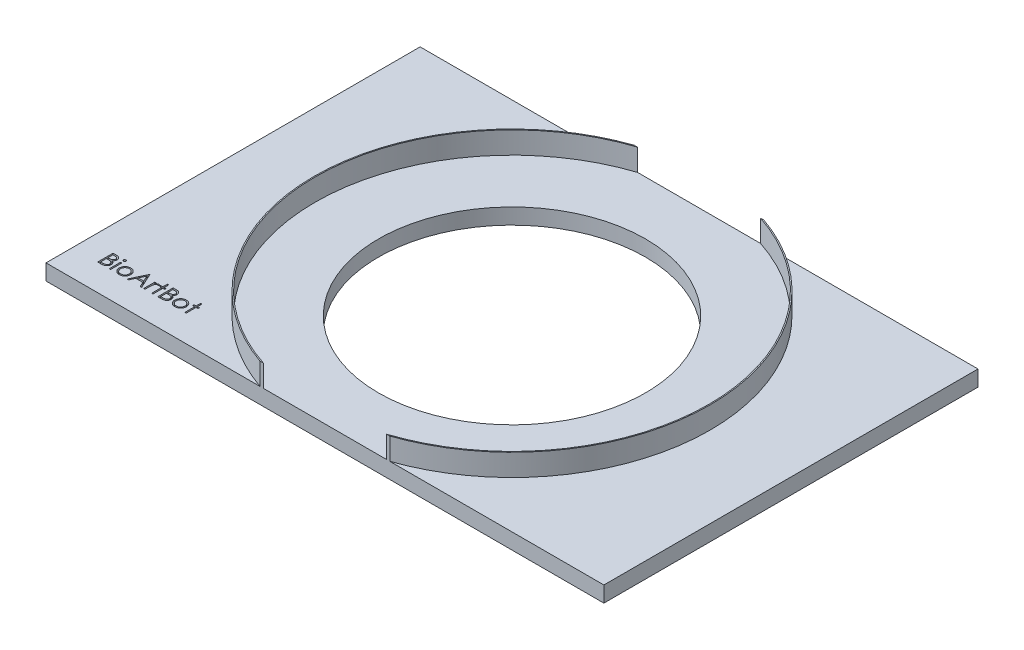
from build123d import *

# Parameters (mm, degrees)
BOSS_EXTRUDE4_DEPTH   = 3.6
BOSS_EXTRUDE4_2_DEPTH = 3.6
BOSS_EXTRUDE5_DEPTH   = 5
SKETCH1_9_R           = 30.5
BOSS_EXTRUDE7_DEPTH   = 3.6
SKETCH2_W             = 0.314102564
SKETCH2_H             = 2.557692308
CUT_EXTRUDE1_DEPTH    = 1


with BuildPart() as part:
    # Sketch1 → Boss-Extrude4 (new body)
    with BuildSketch(Plane(origin=(0, 0, 0), x_dir=(1, 0, 0), z_dir=(0, 1, 0))):
        with BuildLine():
            Line((-63.75, 42.75), (-63.75, -42.75))
            Line((-63.75, -42.75), (-14.832396974, -42.75))
            ThreePointArc((-14.832396974, -42.75), (-45.25, 0), (-14.832396974, 42.75))
            Line((-14.832396974, 42.75), (-63.75, 42.75))
        make_face()
    extrude(amount=-BOSS_EXTRUDE4_DEPTH)



with BuildPart() as body_2:
    # Sketch1 → Boss-Extrude4 2 (new body)
    with BuildSketch(Plane(origin=(0, 0, 0), x_dir=(1, 0, 0), z_dir=(0, 1, 0))):
        with BuildLine():
            ThreePointArc((45.25, 0), (36.869556975, -26.233533282), (14.832396974, -42.75))
            Line((14.832396974, -42.75), (63.75, -42.75))
            Line((63.75, -42.75), (63.75, 42.75))
            Line((63.75, 42.75), (14.832396974, 42.75))
            ThreePointArc((14.832396974, 42.75), (36.869556975, 26.233533282), (45.25, 0))
        make_face()
    extrude(amount=-BOSS_EXTRUDE4_2_DEPTH)


with BuildPart() as body_3:
    # Sketch1<6> → Boss-Extrude5 (new body)
    with BuildSketch(Plane(origin=(0, 0, 0), x_dir=(1, 0, 0), z_dir=(0, 1, 0))):
        with BuildLine():
            ThreePointArc((-14.832396974, 42.75), (-45.25, 0), (-14.832396974, -42.75))
            Line((-14.832396974, -42.75), (-14.051245496, -42.75))
            ThreePointArc((-14.051245496, -42.75), (-45, 0), (-14.051245496, 42.75))
            Line((-14.051245496, 42.75), (-14.832396974, 42.75))
        make_face()
        with BuildLine():
            Line((14.051245496, -42.75), (14.832396974, -42.75))
            ThreePointArc((14.832396974, -42.75), (36.869556975, -26.233533282), (45.25, 0))
            ThreePointArc((45.25, 0), (36.869556975, 26.233533282), (14.832396974, 42.75))
            Line((14.832396974, 42.75), (14.051245496, 42.75))
            ThreePointArc((14.051245496, 42.75), (36.450693048, 26.388387149), (45, 0))
            ThreePointArc((45, 0), (36.450693048, -26.388387149), (14.051245496, -42.75))
        make_face()
    extrude(amount=BOSS_EXTRUDE5_DEPTH)


with BuildPart() as part_1:
    add(part.part)

    add(body_2.part)  # Boss-Extrude7 merges body 2

    add(body_3.part)  # Boss-Extrude7 merges body 3
    # Sketch1<9> → Boss-Extrude7 (add)
    # profile 1 of 5: a face of its own
    with BuildSketch(Plane(origin=(0, 0, 0), x_dir=(1, 0, 0), z_dir=(0, 1, 0))):
        with BuildLine():
            ThreePointArc((-14.051245496, 42.75), (-45, 0), (-14.051245496, -42.75))
            Line((-14.051245496, -42.75), (14.051245496, -42.75))
            ThreePointArc((14.051245496, -42.75), (36.450693048, -26.388387149), (45, 0))
            ThreePointArc((45, 0), (36.450693048, 26.388387149), (14.051245496, 42.75))
            Line((14.051245496, 42.75), (-14.051245496, 42.75))
        make_face()
        with Locations(Location((0, 0, 0), (0, 0, 270))):
            Circle(SKETCH1_9_R, mode=Mode.SUBTRACT)
    # profile 2 of 5: a face of its own
    with BuildSketch(Plane(origin=(0, 0, 0), x_dir=(1, 0, 0), z_dir=(0, 1, 0))):
        with BuildLine():
            ThreePointArc((-14.832396974, 42.75), (-45.25, 0), (-14.832396974, -42.75))
            Line((-14.832396974, -42.75), (-14.051245496, -42.75))
            ThreePointArc((-14.051245496, -42.75), (-45, 0), (-14.051245496, 42.75))
            Line((-14.051245496, 42.75), (-14.832396974, 42.75))
        make_face()
    # profile 3 of 5: a face of its own
    with BuildSketch(Plane(origin=(0, 0, 0), x_dir=(1, 0, 0), z_dir=(0, 1, 0))):
        with BuildLine():
            Line((14.051245496, -42.75), (14.832396974, -42.75))
            ThreePointArc((14.832396974, -42.75), (36.869556975, -26.233533282), (45.25, 0))
            ThreePointArc((45.25, 0), (36.869556975, 26.233533282), (14.832396974, 42.75))
            Line((14.832396974, 42.75), (14.051245496, 42.75))
            ThreePointArc((14.051245496, 42.75), (36.450693048, 26.388387149), (45, 0))
            ThreePointArc((45, 0), (36.450693048, -26.388387149), (14.051245496, -42.75))
        make_face()
    # profile 4 of 5: a face of its own
    with BuildSketch(Plane(origin=(0, 0, 0), x_dir=(1, 0, 0), z_dir=(0, 1, 0))):
        with BuildLine():
            ThreePointArc((-14.832396974, 42.75), (-45.25, 0), (-14.832396974, -42.75))
            Line((-14.832396974, -42.75), (-14.051245496, -42.75))
            ThreePointArc((-14.051245496, -42.75), (-45, 0), (-14.051245496, 42.75))
            Line((-14.051245496, 42.75), (-14.832396974, 42.75))
        make_face()
    # profile 5 of 5: a face of its own
    with BuildSketch(Plane(origin=(0, 0, 0), x_dir=(1, 0, 0), z_dir=(0, 1, 0))):
        with BuildLine():
            Line((14.051245496, -42.75), (14.832396974, -42.75))
            ThreePointArc((14.832396974, -42.75), (36.869556975, -26.233533282), (45.25, 0))
            ThreePointArc((45.25, 0), (36.869556975, 26.233533282), (14.832396974, 42.75))
            Line((14.832396974, 42.75), (14.051245496, 42.75))
            ThreePointArc((14.051245496, 42.75), (36.450693048, 26.388387149), (45, 0))
            ThreePointArc((45, 0), (36.450693048, -26.388387149), (14.051245496, -42.75))
        make_face()
    extrude(amount=-BOSS_EXTRUDE7_DEPTH)

    # Sketch2 → Cut-Extrude1 (cut)
    # profile 1 of 10: a face of its own
    with BuildSketch(Plane(origin=(0, 0, 0), x_dir=(1, 0, 0), z_dir=(0, 1, 0))):
        with BuildLine():
            Line((-58.009767253, -33.174427037), (-57.326874624, -33.174427037))
            add(Edge.make_bspline(
                [(-57.326874624, -33.174427037), (-57.293446146, -33.174602787), (-57.228653436, -33.174943435), (-57.134433994, -33.180226566), (-57.046185183, -33.187430236), (-56.963881411, -33.198860329), (-56.887560709, -33.212652106), (-56.816993071, -33.229353922), (-56.752402899, -33.249380536), (-56.675290163, -33.281226817), (-56.587369502, -33.328549985), (-56.492171109, -33.39847855), (-56.41076687, -33.484011013), (-56.340580552, -33.580493669), (-56.284779433, -33.686629441), (-56.244410136, -33.799888629), (-56.21885226, -33.918810371), (-56.216223826, -34.000453549), (-56.214895458, -34.041714697)],
                knots=[0, 0, 0, 0, 1.001505555, 1.941167018, 2.826882275, 3.653841531, 4.429895133, 5.150066043, 5.825578002, 6.45369114, 7.647487171, 8.808567382, 9.977351308, 11.170798116, 12.373658725, 13.556498008, 14.765093433, 16, 16, 16, 16], degree=3))
            add(Edge.make_bspline(
                [(-56.214895458, -34.041714697), (-56.215988676, -34.080367253), (-56.218136953, -34.15632317), (-56.238679713, -34.267417279), (-56.270840381, -34.373168498), (-56.31554563, -34.473190883), (-56.373647627, -34.565224496), (-56.442505945, -34.650011762), (-56.525582748, -34.723962819), (-56.587825988, -34.765305722), (-56.619442733, -34.786306043)],
                knots=[0, 0, 0, 0, 1.044552857, 2.05264487, 3.044412934, 4.028983338, 5.005914585, 5.980388656, 6.974128949, 8, 8, 8, 8], degree=3))
            add(Edge.make_bspline(
                [(-56.619442733, -34.786306043), (-56.579682306, -34.801571042), (-56.503610758, -34.830776766), (-56.398924746, -34.88241223), (-56.308729901, -34.938574341), (-56.232332755, -34.999906191), (-56.1669951, -35.066015002), (-56.109942158, -35.137870116), (-56.061260784, -35.216408874), (-56.019547861, -35.300812409), (-55.986999105, -35.390218878), (-55.9626232, -35.483789654), (-55.948655751, -35.581189209), (-55.94666811, -35.647474588), (-55.945664688, -35.680937453)],
                knots=[0, 0, 0, 0, 1.27268992, 2.434971085, 3.483601985, 4.442670788, 5.356604649, 6.2567628, 7.179492994, 8.113709626, 9.066344395, 10.018646069, 10.999752585, 12, 12, 12, 12], degree=3))
            add(Edge.make_bspline(
                [(-55.945664688, -35.680937453), (-55.946641534, -35.715104325), (-55.948563506, -35.782328604), (-55.962743478, -35.881083738), (-55.986752585, -35.975458685), (-56.019823732, -36.066063867), (-56.062986046, -36.152724002), (-56.11551401, -36.235537266), (-56.178145574, -36.313671596), (-56.248208443, -36.38799522), (-56.327470588, -36.454823007), (-56.412986343, -36.514338714), (-56.505832663, -36.563284776), (-56.604484657, -36.604400797), (-56.710048973, -36.635807996), (-56.822051581, -36.65778057), (-56.940395883, -36.672585607), (-57.021605634, -36.673802811), (-57.063252829, -36.674427037)],
                knots=[0, 0, 0, 0, 0.978564426, 1.925352924, 2.850884081, 3.763762016, 4.682927383, 5.618979971, 6.567305752, 7.547517671, 8.540179244, 9.531824382, 10.526200242, 11.540722885, 12.589160233, 13.674978461, 14.80764778, 16, 16, 16, 16], degree=3))
            Line((-57.063252829, -36.674427037), (-58.009767253, -36.674427037))
            Line((-58.009767253, -36.674427037), (-58.009767253, -33.174427037))
        make_face()
        with BuildLine():
            Line((-57.695664688, -33.533401396), (-57.695664688, -34.655196267))
            Line((-57.695664688, -34.655196267), (-57.484627028, -34.655196267))
            add(Edge.make_bspline(
                [(-57.484627028, -34.655196267), (-57.453778233, -34.654796344), (-57.394172074, -34.654023612), (-57.307852177, -34.651810095), (-57.227727159, -34.645612051), (-57.153935326, -34.639415789), (-57.086592882, -34.629341201), (-57.02584902, -34.617349079), (-56.970750423, -34.604666173), (-56.907210878, -34.583096687), (-56.835137929, -34.551219011), (-56.758304825, -34.501747175), (-56.690570356, -34.442822822), (-56.633373168, -34.37483186), (-56.586561697, -34.299965674), (-56.554047982, -34.219418794), (-56.532000698, -34.135198662), (-56.530009167, -34.077380409), (-56.528998022, -34.048024793)],
                knots=[0, 0, 0, 0, 1.156816544, 2.235205308, 3.236616184, 4.169592532, 5.011045266, 5.787822928, 6.49130361, 7.128639758, 8.301311294, 9.436451833, 10.541879658, 11.654887649, 12.756523258, 13.837046038, 14.901820046, 16, 16, 16, 16], degree=3))
            add(Edge.make_bspline(
                [(-56.528998022, -34.048024793), (-56.529524202, -34.028599022), (-56.530556362, -33.990493249), (-56.539009664, -33.934943895), (-56.553377239, -33.882700143), (-56.571831532, -33.833046032), (-56.597620221, -33.787534182), (-56.627983684, -33.744590987), (-56.664669374, -33.705678868), (-56.706426687, -33.66930937), (-56.75443531, -33.637064842), (-56.808666602, -33.608824079), (-56.869854279, -33.586083302), (-56.936967134, -33.56616715), (-57.011038221, -33.552178856), (-57.091212775, -33.540525468), (-57.178147494, -33.534592726), (-57.238292596, -33.533807363), (-57.269382637, -33.533401396)],
                knots=[0, 0, 0, 0, 0.91205012, 1.789085906, 2.630437955, 3.453916878, 4.269457761, 5.079663411, 5.91843418, 6.774407191, 7.675494373, 8.627863946, 9.638891023, 10.736472738, 11.911756761, 13.175263542, 14.539845004, 16, 16, 16, 16], degree=3))
            Line((-57.269382637, -33.533401396), (-57.695664688, -33.533401396))
        make_face(mode=Mode.SUBTRACT)
        with BuildLine():
            Line((-57.695664688, -35.014170626), (-57.695664688, -36.315452678))
            Line((-57.695664688, -36.315452678), (-57.248348983, -36.315452678))
            add(Edge.make_bspline(
                [(-57.248348983, -36.315452678), (-57.216330057, -36.31506893), (-57.154617799, -36.314329308), (-57.065516569, -36.311914753), (-56.982933465, -36.306422477), (-56.907245329, -36.297776628), (-56.837634877, -36.288398179), (-56.774937173, -36.275786898), (-56.71864398, -36.261337937), (-56.653369672, -36.239003765), (-56.579866164, -36.204307294), (-56.500655308, -36.151993068), (-56.430229089, -36.08966976), (-56.37042383, -36.017538846), (-56.321410842, -35.939107519), (-56.285755387, -35.855962169), (-56.26376453, -35.769476641), (-56.261102361, -35.710509929), (-56.259767253, -35.680937453)],
                knots=[0, 0, 0, 0, 1.160039823, 2.235823828, 3.228722157, 4.157150951, 4.99529583, 5.772374946, 6.472645482, 7.099169577, 8.269452708, 9.405989375, 10.527446681, 11.663510218, 12.788923519, 13.866172445, 14.929861265, 16, 16, 16, 16], degree=3))
            add(Edge.make_bspline(
                [(-56.259767253, -35.680937453), (-56.260043357, -35.662444113), (-56.260591112, -35.625755731), (-56.268851727, -35.571839912), (-56.280865597, -35.519614038), (-56.296397031, -35.468936298), (-56.319016498, -35.420722922), (-56.345423043, -35.374020362), (-56.376384444, -35.328766883), (-56.42462861, -35.271554629), (-56.494800595, -35.205637616), (-56.59450737, -35.141100114), (-56.707879668, -35.089052307), (-56.790107161, -35.066952831), (-56.832583759, -35.055536812)],
                knots=[0, 0, 0, 0, 0.723448775, 1.435228256, 2.130040452, 2.821711965, 3.505591119, 4.210454504, 4.921174351, 5.648778258, 7.137944449, 8.670945889, 10.280296675, 12, 12, 12, 12], degree=3))
            add(Edge.make_bspline(
                [(-56.832583759, -35.055536812), (-56.849612855, -35.052081728), (-56.886535447, -35.044590394), (-56.946743028, -35.03668269), (-57.015478896, -35.02963763), (-57.092901774, -35.024426473), (-57.179109615, -35.019039929), (-57.274286533, -35.016945108), (-57.378043848, -35.014445848), (-57.450036221, -35.014264714), (-57.487431515, -35.014170626)],
                knots=[0, 0, 0, 0, 0.634451884, 1.375622551, 2.216452059, 3.157844607, 4.20941857, 5.370758133, 6.634282058, 8, 8, 8, 8], degree=3))
            Line((-57.487431515, -35.014170626), (-57.695664688, -35.014170626))
        make_face(mode=Mode.SUBTRACT)
    # profile 2 of 10: a face of its own
    with BuildSketch(Plane(origin=(0, 0, 0), x_dir=(1, 0, 0), z_dir=(0, 1, 0))):
        with BuildLine():
            add(Edge.make_bspline(
                [(-55.206682317, -33.039811652), (-55.187191001, -33.040715804), (-55.149023261, -33.042486308), (-55.093829993, -33.057647786), (-55.043572981, -33.083347471), (-54.998995248, -33.117827152), (-54.960743362, -33.158376595), (-54.933962651, -33.205637564), (-54.916750255, -33.256696202), (-54.9146717, -33.292311292), (-54.913613406, -33.310444665)],
                knots=[0, 0, 0, 0, 1.055194115, 2.066272739, 3.074728998, 4.095836921, 5.109056067, 6.073838105, 7.019297344, 8, 8, 8, 8], degree=3))
            add(Edge.make_bspline(
                [(-54.913613406, -33.310444665), (-54.914695566, -33.328107318), (-54.916834868, -33.363024293), (-54.933949356, -33.413197765), (-54.960971594, -33.459802049), (-54.99897072, -33.500272759), (-55.043579481, -33.534733379), (-55.093828267, -33.560438118), (-55.149023715, -33.575598255), (-55.187191154, -33.577368944), (-55.206682317, -33.57827319)],
                knots=[0, 0, 0, 0, 0.96129708, 1.900370562, 2.859976407, 3.87933698, 4.906634145, 5.921202961, 6.938410037, 8, 8, 8, 8], degree=3))
            add(Edge.make_bspline(
                [(-55.206682317, -33.57827319), (-55.225950592, -33.57740347), (-55.263453772, -33.575710673), (-55.317820614, -33.560140656), (-55.367649104, -33.534724583), (-55.412313776, -33.500498398), (-55.449543969, -33.4595535), (-55.476642295, -33.413226206), (-55.493717257, -33.363017052), (-55.495861885, -33.328104886), (-55.49694674, -33.310444665)],
                knots=[0, 0, 0, 0, 1.054934014, 2.053291228, 3.073705704, 4.106921865, 5.123545215, 6.088680038, 7.033164197, 8, 8, 8, 8], degree=3))
            add(Edge.make_bspline(
                [(-55.49694674, -33.310444665), (-55.495885653, -33.292313815), (-55.493801612, -33.256703683), (-55.476629496, -33.20560865), (-55.449769688, -33.158627148), (-55.412289125, -33.117601648), (-55.367655664, -33.083356214), (-55.317818919, -33.057945232), (-55.26345422, -33.042373893), (-55.225950744, -33.040681278), (-55.206682317, -33.039811652)],
                knots=[0, 0, 0, 0, 0.98631895, 1.937192651, 2.907499808, 3.917963147, 4.944918757, 5.95915025, 6.951458133, 8, 8, 8, 8], degree=3))
        make_face()
    # profile 3 of 10: a face of its own
    with BuildSketch(Plane(origin=(0, 0, 0), x_dir=(1, 0, 0), z_dir=(0, 1, 0))):
        with Locations((-55.205280073, -35.395580883)):
            Rectangle(SKETCH2_W, SKETCH2_H)
    # profile 4 of 10: a face of its own
    with BuildSketch(Plane(origin=(0, 0, 0), x_dir=(1, 0, 0), z_dir=(0, 1, 0))):
        with BuildLine():
            add(Edge.make_bspline(
                [(-53.050031676, -34.071862934), (-53.002040403, -34.072884825), (-52.907941245, -34.074888504), (-52.770133359, -34.09630347), (-52.638588223, -34.129050834), (-52.512802031, -34.174322396), (-52.394385736, -34.235004347), (-52.281614492, -34.307413638), (-52.174797483, -34.393196231), (-52.110774453, -34.4595543), (-52.078276868, -34.493237133)],
                knots=[0, 0, 0, 0, 1.054011418, 2.066658804, 3.057071809, 4.030435133, 4.997543892, 5.974964718, 6.972108034, 8, 8, 8, 8], degree=3))
            add(Edge.make_bspline(
                [(-52.078276868, -34.493237133), (-52.050294914, -34.525451119), (-51.994872534, -34.589255661), (-51.923806815, -34.692711274), (-51.862585255, -34.799851374), (-51.813522294, -34.912098701), (-51.77483727, -35.028473372), (-51.747371574, -35.149375383), (-51.731034639, -35.27453773), (-51.728831672, -35.359541569), (-51.72771597, -35.402592101)],
                knots=[0, 0, 0, 0, 1.025258237, 2.030674902, 3.01204498, 3.988269485, 4.97094183, 5.956517959, 6.965070386, 8, 8, 8, 8], degree=3))
            add(Edge.make_bspline(
                [(-51.72771597, -35.402592101), (-51.728697308, -35.445892158), (-51.730636476, -35.531455092), (-51.748980092, -35.657474458), (-51.777511178, -35.77966928), (-51.818343017, -35.897527974), (-51.870701126, -36.011410801), (-51.934591813, -36.120820351), (-52.01046343, -36.225972484), (-52.096467427, -36.325974322), (-52.191519303, -36.418140537), (-52.294635452, -36.498468807), (-52.403789485, -36.567290331), (-52.520432839, -36.622726747), (-52.643500326, -36.666436447), (-52.773257394, -36.697136463), (-52.909502464, -36.715698147), (-53.002529685, -36.71808172), (-53.050031676, -36.719298831)],
                knots=[0, 0, 0, 0, 0.998656419, 1.973391657, 2.932242238, 3.890759089, 4.846373663, 5.82037756, 6.809684879, 7.83454468, 8.860553229, 9.859544525, 10.845671541, 11.83227036, 12.833544569, 13.85385346, 14.904124723, 16, 16, 16, 16], degree=3))
            add(Edge.make_bspline(
                [(-53.050031676, -36.719298831), (-53.097766395, -36.718077635), (-53.191257255, -36.715685861), (-53.327983237, -36.697208578), (-53.457972856, -36.666450595), (-53.581201454, -36.622583103), (-53.698346301, -36.567288559), (-53.808132798, -36.498676869), (-53.911332714, -36.418116714), (-54.006404698, -36.325980777), (-54.092403303, -36.225970821), (-54.168276312, -36.120820782), (-54.232166638, -36.011410689), (-54.284524842, -35.897528004), (-54.325356655, -35.779669272), (-54.353887747, -35.65747446), (-54.372231362, -35.531455091), (-54.37417053, -35.445892158), (-54.375151868, -35.402592101)],
                knots=[0, 0, 0, 0, 1.099876186, 2.154163076, 3.173186993, 4.173200201, 5.163417411, 6.152872554, 7.150605724, 8.17532212, 9.198891216, 10.186952605, 11.159729845, 12.11414092, 13.071450619, 14.029093627, 15.002601286, 16, 16, 16, 16], degree=3))
            add(Edge.make_bspline(
                [(-54.375151868, -35.402592101), (-54.374028558, -35.359775555), (-54.371804596, -35.275006152), (-54.355484087, -35.150079092), (-54.328125531, -35.029381703), (-54.289394134, -34.913456227), (-54.239878943, -34.801700791), (-54.179517655, -34.69429596), (-54.107727023, -34.591308159), (-54.052525071, -34.527586079), (-54.02459097, -34.495340498)],
                knots=[0, 0, 0, 0, 1.031353054, 2.041901799, 3.029428768, 4.008703097, 4.981709435, 5.96992636, 6.972712378, 8, 8, 8, 8], degree=3))
            add(Edge.make_bspline(
                [(-54.02459097, -34.495340498), (-53.992142379, -34.461365559), (-53.928326516, -34.394547863), (-53.820977788, -34.309015339), (-53.708483967, -34.235099265), (-53.588759041, -34.175623049), (-53.463076183, -34.128784532), (-53.33085694, -34.096219016), (-53.192581425, -34.074965661), (-53.098021804, -34.072907484), (-53.050031676, -34.071862934)],
                knots=[0, 0, 0, 0, 1.027980169, 2.021703884, 2.998553061, 3.971491411, 4.943284454, 5.930300938, 6.949603206, 8, 8, 8, 8], degree=3))
        make_face()
        with BuildLine():
            add(Edge.make_bspline(
                [(-53.051433919, -34.385965498), (-53.08537153, -34.38693009), (-53.152370659, -34.388834372), (-53.250990244, -34.403318277), (-53.345930398, -34.426265781), (-53.437371242, -34.458869837), (-53.525004414, -34.500968736), (-53.608913817, -34.552677097), (-53.689346257, -34.613310053), (-53.76472832, -34.682772725), (-53.833910632, -34.758651719), (-53.894388609, -34.839500078), (-53.945813715, -34.924006424), (-53.988653874, -35.012258635), (-54.020561062, -35.105151049), (-54.043734085, -35.201631681), (-54.058204325, -35.301897097), (-54.060090704, -35.370058115), (-54.061049304, -35.404695466)],
                knots=[0, 0, 0, 0, 1.021534396, 2.016698045, 2.994645724, 3.958388632, 4.93408049, 5.916473867, 6.921342795, 7.962252576, 8.998418191, 10.008913653, 10.997312074, 11.973003931, 12.956656626, 13.948281152, 14.957379055, 16, 16, 16, 16], degree=3))
            add(Edge.make_bspline(
                [(-54.061049304, -35.404695466), (-54.05944248, -35.449447493), (-54.056253236, -35.538271899), (-54.030317999, -35.669083021), (-53.986931719, -35.794664874), (-53.92834444, -35.91428126), (-53.854938221, -36.024953538), (-53.768451154, -36.123625022), (-53.669811454, -36.208810833), (-53.560194954, -36.279491679), (-53.441840636, -36.335651435), (-53.316584315, -36.37545041), (-53.185943621, -36.401322103), (-53.09666289, -36.403893577), (-53.051433919, -36.405196267)],
                knots=[0, 0, 0, 0, 1.016792936, 2.018143844, 3.017858371, 4.030088057, 5.03801393, 6.028138512, 7.003788237, 7.991172063, 8.984598303, 9.972568034, 10.972917682, 12, 12, 12, 12], degree=3))
            add(Edge.make_bspline(
                [(-53.051433919, -36.405196267), (-53.00620755, -36.403885987), (-52.916931954, -36.40129953), (-52.786472777, -36.375580711), (-52.661558806, -36.33547705), (-52.543327418, -36.27955484), (-52.433760815, -36.208542425), (-52.334411693, -36.124106048), (-52.248663082, -36.024692197), (-52.175329477, -35.914134668), (-52.115782735, -35.794850316), (-52.072599533, -35.669059844), (-52.046601947, -35.538277802), (-52.043421118, -35.449449471), (-52.041818535, -35.404695466)],
                knots=[0, 0, 0, 0, 1.02726834, 2.027799167, 3.010890988, 4.004497153, 4.992059811, 5.971914811, 6.958719428, 7.966827853, 8.981595046, 9.981490638, 10.983022906, 12, 12, 12, 12], degree=3))
            add(Edge.make_bspline(
                [(-52.041818535, -35.404695466), (-52.042776805, -35.370057908), (-52.044662534, -35.301896483), (-52.059137498, -35.201634029), (-52.082293038, -35.105142433), (-52.114264655, -35.012290429), (-52.156918669, -34.923777925), (-52.209335462, -34.839748198), (-52.269566487, -34.758371652), (-52.339583608, -34.683018011), (-52.414886986, -34.613282974), (-52.495352024, -34.552653585), (-52.579137003, -34.50119599), (-52.666515586, -34.458509749), (-52.757968153, -34.426562409), (-52.852775282, -34.403185777), (-52.950974092, -34.388895581), (-53.017733135, -34.386948439), (-53.051433919, -34.385965498)],
                knots=[0, 0, 0, 0, 1.042956736, 2.052379634, 3.044323526, 4.02829302, 5.004299113, 5.996692471, 7.007513377, 8.048758398, 9.090003419, 10.095195979, 11.07790575, 12.047570684, 13.018257071, 13.989683339, 14.985167495, 16, 16, 16, 16], degree=3))
        make_face(mode=Mode.SUBTRACT)
    # profile 5 of 10: a face of its own
    with BuildSketch(Plane(origin=(0, 0, 0), x_dir=(1, 0, 0), z_dir=(0, 1, 0))):
        Polygon((-49.573869817, -33.174427037), (-47.958485201, -36.674427037), (-48.299931515, -36.674427037), (-48.8173594, -35.552632165), (-50.403998022, -35.552632165), (-50.936149464, -36.674427037), (-51.278998022, -36.674427037), (-49.618741611, -33.174427037), align=None)
        Polygon((-49.599811323, -33.856618543), (-50.233625426, -35.193657806), (-48.982824144, -35.193657806), align=None, mode=Mode.SUBTRACT)
    # profile 6 of 10: a face of its own
    with BuildSketch(Plane(origin=(0, 0, 0), x_dir=(1, 0, 0), z_dir=(0, 1, 0))):
        with BuildLine():
            Line((-47.509767253, -34.116734729), (-47.195664688, -34.116734729))
            Line((-47.195664688, -34.116734729), (-47.195664688, -34.493237133))
            add(Edge.make_bspline(
                [(-47.195664688, -34.493237133), (-47.17247593, -34.458181304), (-47.128127609, -34.391137305), (-47.054414679, -34.302468004), (-46.978911348, -34.229052958), (-46.901256161, -34.170549439), (-46.820878061, -34.12673632), (-46.739541109, -34.094643285), (-46.655965639, -34.07566597), (-46.599803715, -34.073132311), (-46.571666291, -34.071862934)],
                knots=[0, 0, 0, 0, 1.2804753, 2.448899062, 3.506932113, 4.484331642, 5.4025378, 6.288909075, 7.142734305, 8, 8, 8, 8], degree=3))
            add(Edge.make_bspline(
                [(-46.571666291, -34.071862934), (-46.549839964, -34.073053461), (-46.504930879, -34.075503046), (-46.436948289, -34.092713871), (-46.366904838, -34.120191894), (-46.32176245, -34.146032116), (-46.298228791, -34.159503158)],
                knots=[0, 0, 0, 0, 0.901110191, 1.854092781, 2.881294221, 4, 4, 4, 4], degree=3))
            Line((-46.298228791, -34.159503158), (-46.470704753, -34.431538415))
            add(Edge.make_bspline(
                [(-46.470704753, -34.431538415), (-46.485813774, -34.424798149), (-46.514493588, -34.412003833), (-46.556448154, -34.396861823), (-46.595129491, -34.387945907), (-46.61977305, -34.38659519), (-46.631261644, -34.385965498)],
                knots=[0, 0, 0, 0, 1.180555205, 2.24091978, 3.179933427, 4, 4, 4, 4], degree=3))
            add(Edge.make_bspline(
                [(-46.631261644, -34.385965498), (-46.656467377, -34.387645536), (-46.707879767, -34.391072325), (-46.783364266, -34.418011133), (-46.856611472, -34.461536373), (-46.914783134, -34.509807484), (-46.959825387, -34.556355282), (-46.991965613, -34.597003685), (-47.02144836, -34.642582316), (-47.04961858, -34.692312), (-47.075284874, -34.747041846), (-47.099239543, -34.806225059), (-47.120898406, -34.869930188), (-47.133248651, -34.914312708), (-47.139574945, -34.937047229)],
                knots=[0, 0, 0, 0, 1.125678352, 2.296057538, 3.5422874, 4.923748041, 5.663163013, 6.437101912, 7.23742474, 8.08941207, 8.991984279, 9.93940061, 10.944477711, 12, 12, 12, 12], degree=3))
            add(Edge.make_bspline(
                [(-47.139574945, -34.937047229), (-47.144307338, -34.957324403), (-47.15478923, -35.002236801), (-47.164980768, -35.077585326), (-47.175050286, -35.166608985), (-47.182146904, -35.269555578), (-47.188724946, -35.386168021), (-47.192435028, -35.516623967), (-47.195538169, -35.661057318), (-47.195621236, -35.762031671), (-47.195664688, -35.814851716)],
                knots=[0, 0, 0, 0, 0.566838948, 1.255505196, 2.06880316, 3.007127437, 4.065329342, 5.249902469, 6.561414163, 8, 8, 8, 8], degree=3))
            Line((-47.195664688, -35.814851716), (-47.195664688, -36.674427037))
            Line((-47.195664688, -36.674427037), (-47.509767253, -36.674427037))
            Line((-47.509767253, -36.674427037), (-47.509767253, -34.116734729))
        make_face()
    # profile 7 of 10: a face of its own
    with BuildSketch(Plane(origin=(0, 0, 0), x_dir=(1, 0, 0), z_dir=(0, 1, 0))):
        Polygon((-45.670023663, -33.084683447), (-45.355921099, -33.084683447), (-45.355921099, -34.116734729), (-44.90720315, -34.116734729), (-44.90720315, -34.430837293), (-45.355921099, -34.430837293), (-45.355921099, -36.674427037), (-45.670023663, -36.674427037), (-45.670023663, -34.430837293), (-46.118741611, -34.430837293), (-46.118741611, -34.116734729), (-45.670023663, -34.116734729), align=None)
    # profile 8 of 10: a face of its own
    with BuildSketch(Plane(origin=(0, 0, 0), x_dir=(1, 0, 0), z_dir=(0, 1, 0))):
        with BuildLine():
            Line((-44.278998022, -33.174427037), (-43.596105394, -33.174427037))
            add(Edge.make_bspline(
                [(-43.596105394, -33.174427037), (-43.562676915, -33.174602787), (-43.497884205, -33.174943435), (-43.403664763, -33.180226566), (-43.315415953, -33.187430236), (-43.23311218, -33.198860329), (-43.156791478, -33.212652106), (-43.086223841, -33.229353922), (-43.021633668, -33.249380536), (-42.944520932, -33.281226817), (-42.856600271, -33.328549985), (-42.761401878, -33.39847855), (-42.679997639, -33.484011013), (-42.609811322, -33.580493669), (-42.554010202, -33.686629441), (-42.513640905, -33.799888629), (-42.488083029, -33.918810371), (-42.485454595, -34.000453549), (-42.484126227, -34.041714697)],
                knots=[0, 0, 0, 0, 1.001505555, 1.941167018, 2.826882275, 3.653841531, 4.429895133, 5.150066043, 5.825578002, 6.45369114, 7.647487171, 8.808567382, 9.977351308, 11.170798116, 12.373658725, 13.556498008, 14.765093433, 16, 16, 16, 16], degree=3))
            add(Edge.make_bspline(
                [(-42.484126227, -34.041714697), (-42.485219445, -34.080367253), (-42.487367723, -34.15632317), (-42.507910482, -34.267417279), (-42.54007115, -34.373168498), (-42.5847764, -34.473190883), (-42.642878396, -34.565224496), (-42.711736714, -34.650011762), (-42.794813517, -34.723962819), (-42.857056757, -34.765305722), (-42.888673503, -34.786306043)],
                knots=[0, 0, 0, 0, 1.044552857, 2.05264487, 3.044412934, 4.028983338, 5.005914585, 5.980388656, 6.974128949, 8, 8, 8, 8], degree=3))
            add(Edge.make_bspline(
                [(-42.888673503, -34.786306043), (-42.848913075, -34.801571042), (-42.772841528, -34.830776766), (-42.668155515, -34.88241223), (-42.57796067, -34.938574341), (-42.501563524, -34.999906191), (-42.436225869, -35.066015002), (-42.379172928, -35.137870116), (-42.330491553, -35.216408874), (-42.28877863, -35.300812409), (-42.256229874, -35.390218878), (-42.23185397, -35.483789654), (-42.21788652, -35.581189209), (-42.215898879, -35.647474588), (-42.214895458, -35.680937453)],
                knots=[0, 0, 0, 0, 1.27268992, 2.434971085, 3.483601985, 4.442670788, 5.356604649, 6.2567628, 7.179492994, 8.113709626, 9.066344395, 10.018646069, 10.999752585, 12, 12, 12, 12], degree=3))
            add(Edge.make_bspline(
                [(-42.214895458, -35.680937453), (-42.215872304, -35.715104325), (-42.217794276, -35.782328604), (-42.231974247, -35.881083738), (-42.255983354, -35.975458685), (-42.289054501, -36.066063867), (-42.332216815, -36.152724002), (-42.38474478, -36.235537266), (-42.447376343, -36.313671596), (-42.517439212, -36.38799522), (-42.596701358, -36.454823007), (-42.682217113, -36.514338714), (-42.775063433, -36.563284776), (-42.873715427, -36.604400797), (-42.979279743, -36.635807996), (-43.09128235, -36.65778057), (-43.209626652, -36.672585607), (-43.290836403, -36.673802811), (-43.332483599, -36.674427037)],
                knots=[0, 0, 0, 0, 0.978564426, 1.925352924, 2.850884081, 3.763762016, 4.682927383, 5.618979971, 6.567305752, 7.547517671, 8.540179244, 9.531824382, 10.526200242, 11.540722885, 12.589160233, 13.674978461, 14.80764778, 16, 16, 16, 16], degree=3))
            Line((-43.332483599, -36.674427037), (-44.278998022, -36.674427037))
            Line((-44.278998022, -36.674427037), (-44.278998022, -33.174427037))
        make_face()
        with BuildLine():
            Line((-43.964895458, -33.533401396), (-43.964895458, -34.655196267))
            Line((-43.964895458, -34.655196267), (-43.753857797, -34.655196267))
            add(Edge.make_bspline(
                [(-43.753857797, -34.655196267), (-43.723009002, -34.654796344), (-43.663402843, -34.654023612), (-43.577082946, -34.651810095), (-43.496957928, -34.645612051), (-43.423166095, -34.639415789), (-43.355823651, -34.629341201), (-43.295079789, -34.617349079), (-43.239981193, -34.604666173), (-43.176441647, -34.583096687), (-43.104368699, -34.551219011), (-43.027535594, -34.501747175), (-42.959801125, -34.442822822), (-42.902603937, -34.37483186), (-42.855792467, -34.299965674), (-42.823278751, -34.219418794), (-42.801231467, -34.135198662), (-42.799239936, -34.077380409), (-42.798228791, -34.048024793)],
                knots=[0, 0, 0, 0, 1.156816544, 2.235205308, 3.236616184, 4.169592532, 5.011045266, 5.787822928, 6.49130361, 7.128639758, 8.301311294, 9.436451833, 10.541879658, 11.654887649, 12.756523258, 13.837046038, 14.901820046, 16, 16, 16, 16], degree=3))
            add(Edge.make_bspline(
                [(-42.798228791, -34.048024793), (-42.798754971, -34.028599022), (-42.799787131, -33.990493249), (-42.808240434, -33.934943895), (-42.822608008, -33.882700143), (-42.841062301, -33.833046032), (-42.86685099, -33.787534182), (-42.897214453, -33.744590987), (-42.933900144, -33.705678868), (-42.975657456, -33.66930937), (-43.023666079, -33.637064842), (-43.077897371, -33.608824079), (-43.139085048, -33.586083302), (-43.206197903, -33.56616715), (-43.280268991, -33.552178856), (-43.360443544, -33.540525468), (-43.447378263, -33.534592726), (-43.507523365, -33.533807363), (-43.538613406, -33.533401396)],
                knots=[0, 0, 0, 0, 0.91205012, 1.789085906, 2.630437955, 3.453916878, 4.269457761, 5.079663411, 5.91843418, 6.774407191, 7.675494373, 8.627863946, 9.638891023, 10.736472738, 11.911756761, 13.175263542, 14.539845004, 16, 16, 16, 16], degree=3))
            Line((-43.538613406, -33.533401396), (-43.964895458, -33.533401396))
        make_face(mode=Mode.SUBTRACT)
        with BuildLine():
            Line((-43.964895458, -35.014170626), (-43.964895458, -36.315452678))
            Line((-43.964895458, -36.315452678), (-43.517579753, -36.315452678))
            add(Edge.make_bspline(
                [(-43.517579753, -36.315452678), (-43.485560827, -36.31506893), (-43.423848568, -36.314329308), (-43.334747338, -36.311914753), (-43.252164234, -36.306422477), (-43.176476098, -36.297776628), (-43.106865646, -36.288398179), (-43.044167943, -36.275786898), (-42.987874749, -36.261337937), (-42.922600442, -36.239003765), (-42.849096933, -36.204307294), (-42.769886077, -36.151993068), (-42.699459859, -36.08966976), (-42.639654599, -36.017538846), (-42.590641611, -35.939107519), (-42.554986156, -35.855962169), (-42.532995299, -35.769476641), (-42.53033313, -35.710509929), (-42.528998022, -35.680937453)],
                knots=[0, 0, 0, 0, 1.160039823, 2.235823828, 3.228722157, 4.157150951, 4.99529583, 5.772374946, 6.472645482, 7.099169577, 8.269452708, 9.405989375, 10.527446681, 11.663510218, 12.788923519, 13.866172445, 14.929861265, 16, 16, 16, 16], degree=3))
            add(Edge.make_bspline(
                [(-42.528998022, -35.680937453), (-42.529274126, -35.662444113), (-42.529821881, -35.625755731), (-42.538082496, -35.571839912), (-42.550096366, -35.519614038), (-42.5656278, -35.468936298), (-42.588247267, -35.420722922), (-42.614653812, -35.374020362), (-42.645615214, -35.328766883), (-42.693859379, -35.271554629), (-42.764031364, -35.205637616), (-42.863738139, -35.141100114), (-42.977110437, -35.089052307), (-43.05933793, -35.066952831), (-43.101814528, -35.055536812)],
                knots=[0, 0, 0, 0, 0.723448775, 1.435228256, 2.130040452, 2.821711965, 3.505591119, 4.210454504, 4.921174351, 5.648778258, 7.137944449, 8.670945889, 10.280296675, 12, 12, 12, 12], degree=3))
            add(Edge.make_bspline(
                [(-43.101814528, -35.055536812), (-43.118843624, -35.052081728), (-43.155766216, -35.044590394), (-43.215973797, -35.03668269), (-43.284709666, -35.02963763), (-43.362132543, -35.024426473), (-43.448340384, -35.019039929), (-43.543517303, -35.016945108), (-43.647274617, -35.014445848), (-43.71926699, -35.014264714), (-43.756662285, -35.014170626)],
                knots=[0, 0, 0, 0, 0.634451884, 1.375622551, 2.216452059, 3.157844607, 4.20941857, 5.370758133, 6.634282058, 8, 8, 8, 8], degree=3))
            Line((-43.756662285, -35.014170626), (-43.964895458, -35.014170626))
        make_face(mode=Mode.SUBTRACT)
    # profile 9 of 10: a face of its own
    with BuildSketch(Plane(origin=(0, 0, 0), x_dir=(1, 0, 0), z_dir=(0, 1, 0))):
        with BuildLine():
            add(Edge.make_bspline(
                [(-40.351313727, -34.071862934), (-40.303322454, -34.072884825), (-40.209223296, -34.074888504), (-40.071415411, -34.09630347), (-39.939870275, -34.129050834), (-39.814084082, -34.174322396), (-39.695667787, -34.235004347), (-39.582896543, -34.307413638), (-39.476079534, -34.393196231), (-39.412056505, -34.4595543), (-39.379558919, -34.493237133)],
                knots=[0, 0, 0, 0, 1.054011418, 2.066658804, 3.057071809, 4.030435133, 4.997543892, 5.974964718, 6.972108034, 8, 8, 8, 8], degree=3))
            add(Edge.make_bspline(
                [(-39.379558919, -34.493237133), (-39.351576965, -34.525451119), (-39.296154585, -34.589255661), (-39.225088866, -34.692711274), (-39.163867306, -34.799851374), (-39.114804345, -34.912098701), (-39.076119321, -35.028473372), (-39.048653625, -35.149375383), (-39.03231669, -35.27453773), (-39.030113723, -35.359541569), (-39.028998022, -35.402592101)],
                knots=[0, 0, 0, 0, 1.025258237, 2.030674902, 3.01204498, 3.988269485, 4.97094183, 5.956517959, 6.965070386, 8, 8, 8, 8], degree=3))
            add(Edge.make_bspline(
                [(-39.028998022, -35.402592101), (-39.029979359, -35.445892158), (-39.031918527, -35.531455092), (-39.050262144, -35.657474458), (-39.07879323, -35.77966928), (-39.119625068, -35.897527974), (-39.171983177, -36.011410801), (-39.235873865, -36.120820351), (-39.311745482, -36.225972484), (-39.397749479, -36.325974322), (-39.492801355, -36.418140537), (-39.595917503, -36.498468807), (-39.705071537, -36.567290331), (-39.82171489, -36.622726747), (-39.944782377, -36.666436447), (-40.074539445, -36.697136463), (-40.210784515, -36.715698147), (-40.303811737, -36.71808172), (-40.351313727, -36.719298831)],
                knots=[0, 0, 0, 0, 0.998656419, 1.973391657, 2.932242238, 3.890759089, 4.846373663, 5.82037756, 6.809684879, 7.83454468, 8.860553229, 9.859544525, 10.845671541, 11.83227036, 12.833544569, 13.85385346, 14.904124723, 16, 16, 16, 16], degree=3))
            add(Edge.make_bspline(
                [(-40.351313727, -36.719298831), (-40.399048446, -36.718077635), (-40.492539306, -36.715685861), (-40.629265288, -36.697208578), (-40.759254907, -36.666450595), (-40.882483505, -36.622583103), (-40.999628352, -36.567288559), (-41.109414849, -36.498676869), (-41.212614765, -36.418116714), (-41.307686749, -36.325980777), (-41.393685355, -36.225970821), (-41.469558363, -36.120820782), (-41.533448689, -36.011410689), (-41.585806893, -35.897528004), (-41.626638706, -35.779669272), (-41.655169799, -35.65747446), (-41.673513413, -35.531455091), (-41.675452582, -35.445892158), (-41.676433919, -35.402592101)],
                knots=[0, 0, 0, 0, 1.099876186, 2.154163076, 3.173186993, 4.173200201, 5.163417411, 6.152872554, 7.150605724, 8.17532212, 9.198891216, 10.186952605, 11.159729845, 12.11414092, 13.071450619, 14.029093627, 15.002601286, 16, 16, 16, 16], degree=3))
            add(Edge.make_bspline(
                [(-41.676433919, -35.402592101), (-41.675310609, -35.359775555), (-41.673086647, -35.275006152), (-41.656766138, -35.150079092), (-41.629407582, -35.029381703), (-41.590676185, -34.913456227), (-41.541160994, -34.801700791), (-41.480799707, -34.69429596), (-41.409009074, -34.591308159), (-41.353807122, -34.527586079), (-41.325873022, -34.495340498)],
                knots=[0, 0, 0, 0, 1.031353054, 2.041901799, 3.029428768, 4.008703097, 4.981709435, 5.96992636, 6.972712378, 8, 8, 8, 8], degree=3))
            add(Edge.make_bspline(
                [(-41.325873022, -34.495340498), (-41.293424431, -34.461365559), (-41.229608567, -34.394547863), (-41.122259839, -34.309015339), (-41.009766018, -34.235099265), (-40.890041092, -34.175623049), (-40.764358234, -34.128784532), (-40.632138991, -34.096219016), (-40.493863476, -34.074965661), (-40.399303855, -34.072907484), (-40.351313727, -34.071862934)],
                knots=[0, 0, 0, 0, 1.027980169, 2.021703884, 2.998553061, 3.971491411, 4.943284454, 5.930300938, 6.949603206, 8, 8, 8, 8], degree=3))
        make_face()
        with BuildLine():
            add(Edge.make_bspline(
                [(-40.35271597, -34.385965498), (-40.386653582, -34.38693009), (-40.45365271, -34.388834372), (-40.552272295, -34.403318277), (-40.647212449, -34.426265781), (-40.738653293, -34.458869837), (-40.826286466, -34.500968736), (-40.910195868, -34.552677097), (-40.990628308, -34.613310053), (-41.066010371, -34.682772725), (-41.135192683, -34.758651719), (-41.19567066, -34.839500078), (-41.247095766, -34.924006424), (-41.289935925, -35.012258635), (-41.321843113, -35.105151049), (-41.345016136, -35.201631681), (-41.359486376, -35.301897097), (-41.361372755, -35.370058115), (-41.362331355, -35.404695466)],
                knots=[0, 0, 0, 0, 1.021534396, 2.016698045, 2.994645724, 3.958388632, 4.93408049, 5.916473867, 6.921342795, 7.962252576, 8.998418191, 10.008913653, 10.997312074, 11.973003931, 12.956656626, 13.948281152, 14.957379055, 16, 16, 16, 16], degree=3))
            add(Edge.make_bspline(
                [(-41.362331355, -35.404695466), (-41.360724531, -35.449447493), (-41.357535287, -35.538271899), (-41.331600051, -35.669083021), (-41.288213771, -35.794664874), (-41.229626491, -35.91428126), (-41.156220272, -36.024953538), (-41.069733206, -36.123625022), (-40.971093505, -36.208810833), (-40.861477005, -36.279491679), (-40.743122687, -36.335651435), (-40.617866366, -36.37545041), (-40.487225672, -36.401322103), (-40.397944941, -36.403893577), (-40.35271597, -36.405196267)],
                knots=[0, 0, 0, 0, 1.016792936, 2.018143844, 3.017858371, 4.030088057, 5.03801393, 6.028138512, 7.003788237, 7.991172063, 8.984598303, 9.972568034, 10.972917682, 12, 12, 12, 12], degree=3))
            add(Edge.make_bspline(
                [(-40.35271597, -36.405196267), (-40.307489602, -36.403885987), (-40.218214006, -36.40129953), (-40.087754829, -36.375580711), (-39.962840857, -36.33547705), (-39.844609469, -36.27955484), (-39.735042866, -36.208542425), (-39.635693745, -36.124106048), (-39.549945133, -36.024692197), (-39.476611529, -35.914134668), (-39.417064786, -35.794850316), (-39.373881584, -35.669059844), (-39.347883998, -35.538277802), (-39.344703169, -35.449449471), (-39.343100586, -35.404695466)],
                knots=[0, 0, 0, 0, 1.02726834, 2.027799167, 3.010890988, 4.004497153, 4.992059811, 5.971914811, 6.958719428, 7.966827853, 8.981595046, 9.981490638, 10.983022906, 12, 12, 12, 12], degree=3))
            add(Edge.make_bspline(
                [(-39.343100586, -35.404695466), (-39.344058856, -35.370057908), (-39.345944585, -35.301896483), (-39.360419549, -35.201634029), (-39.383575089, -35.105142433), (-39.415546706, -35.012290429), (-39.45820072, -34.923777925), (-39.510617513, -34.839748198), (-39.570848539, -34.758371652), (-39.64086566, -34.683018011), (-39.716169037, -34.613282974), (-39.796634076, -34.552653585), (-39.880419054, -34.50119599), (-39.967797637, -34.458509749), (-40.059250204, -34.426562409), (-40.154057334, -34.403185777), (-40.252256144, -34.388895581), (-40.319015187, -34.386948439), (-40.35271597, -34.385965498)],
                knots=[0, 0, 0, 0, 1.042956736, 2.052379634, 3.044323526, 4.02829302, 5.004299113, 5.996692471, 7.007513377, 8.048758398, 9.090003419, 10.095195979, 11.07790575, 12.047570684, 13.018257071, 13.989683339, 14.985167495, 16, 16, 16, 16], degree=3))
        make_face(mode=Mode.SUBTRACT)
    # profile 10 of 10: a face of its own
    with BuildSketch(Plane(origin=(0, 0, 0), x_dir=(1, 0, 0), z_dir=(0, 1, 0))):
        Polygon((-38.086690329, -33.084683447), (-37.772587765, -33.084683447), (-37.772587765, -34.116734729), (-37.323869817, -34.116734729), (-37.323869817, -34.430837293), (-37.772587765, -34.430837293), (-37.772587765, -36.674427037), (-38.086690329, -36.674427037), (-38.086690329, -34.430837293), (-38.535408278, -34.430837293), (-38.535408278, -34.116734729), (-38.086690329, -34.116734729), align=None)
    extrude(amount=-CUT_EXTRUDE1_DEPTH, mode=Mode.SUBTRACT)


solid = part_1.part
